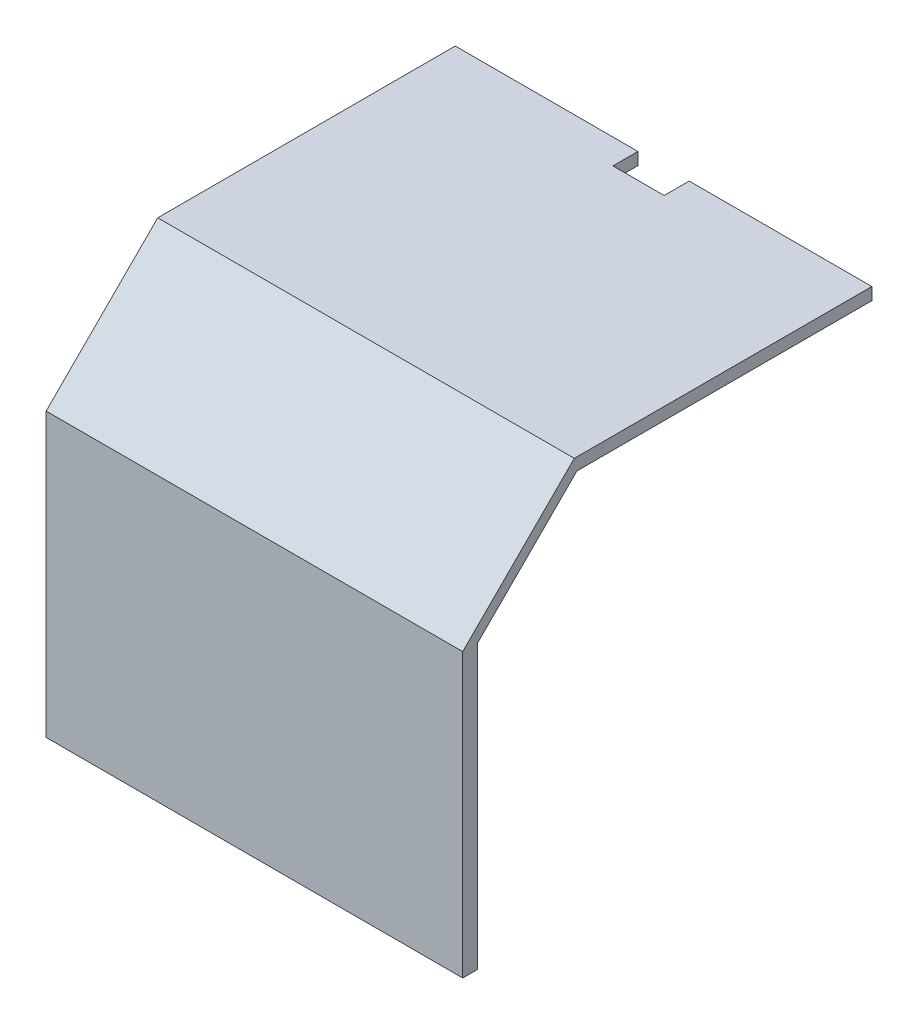
from build123d import *

# Parameters (mm, degrees)
SKETCH1_W           = 1120
SKETCH1_H           = 40
BOSS_EXTRUDE1_DEPTH = 760
BOSS_EXTRUDE2_DEPTH = 1120
BOSS_EXTRUDE3_DEPTH = 1120
SKETCH4_W           = 137.769014226
SKETCH4_H           = 67.23794826
CUT_EXTRUDE1_DEPTH  = 1120


with BuildPart() as part:
    # Sketch1 → Boss-Extrude1 (new body)
    with BuildSketch(Plane(origin=(0, 0, 0), x_dir=(1, 0, 0), z_dir=(0, 1, 0))):
        Rectangle(SKETCH1_W, SKETCH1_H)
    extrude(amount=BOSS_EXTRUDE1_DEPTH)

    # Sketch2 → Boss-Extrude2 (add)
    with BuildSketch(Plane(origin=(560, 0, 0), x_dir=(0, 0, -1), z_dir=(1, 0, 0))):
        Polygon((-20, 760), (280, 1060), (320, 1060), (20, 760), align=None)
    extrude(amount=-BOSS_EXTRUDE2_DEPTH)

    # Sketch3 → Boss-Extrude3 (add)
    with BuildSketch(Plane(origin=(560, 0, 0), x_dir=(0, 0, -1), z_dir=(1, 0, 0))):
        Polygon((320, 1060), (1080, 1060), (1080, 1027), (285.570778589, 1027), align=None)
    extrude(amount=-BOSS_EXTRUDE3_DEPTH)

    # Sketch4 → Cut-Extrude1 (cut)
    with BuildSketch(Plane(origin=(0, 1060, 0), x_dir=(1, 0, 0), z_dir=(0, 1, 0))):
        with Locations((0, 1046.38102587)):
            Rectangle(SKETCH4_W, SKETCH4_H)
    extrude(amount=-CUT_EXTRUDE1_DEPTH, mode=Mode.SUBTRACT)


solid = part.part
